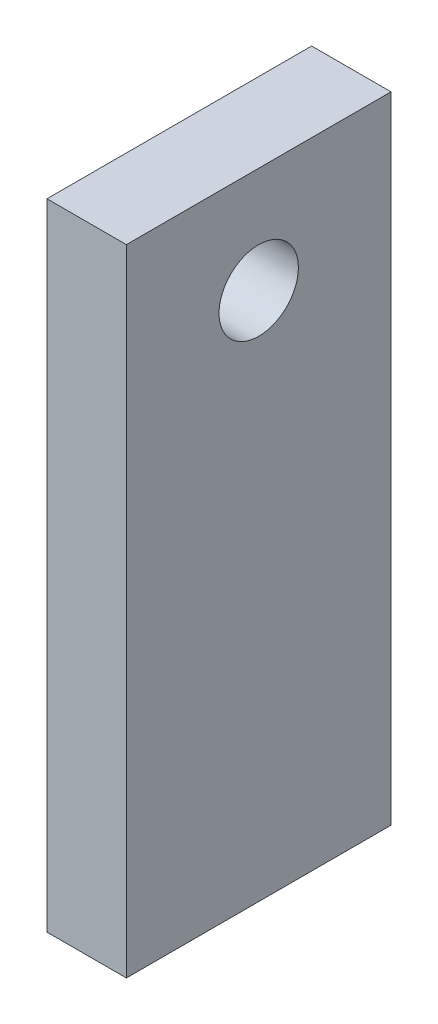
from build123d import *

# Parameters (mm, degrees)
SKETCH1_W           = 50
SKETCH1_H           = 120
BOSS_EXTRUDE1_DEPTH = 15
CUT_EXTRUDE1_REACH  = 68.708
SKETCH2_R           = 7.5


with BuildPart() as part:
    # Sketch1 → Boss-Extrude1 (new body)
    with BuildSketch(Plane(origin=(0, 0, 0), x_dir=(0, 0, -1), z_dir=(1, 0, 0))):
        Rectangle(SKETCH1_W, SKETCH1_H)
    extrude(amount=BOSS_EXTRUDE1_DEPTH)

    # Sketch2 → Cut-Extrude1 (cut, up to next)
    with BuildSketch(Plane(origin=(15, 0, 0), x_dir=(0, 0, -1), z_dir=(1, 0, 0)), mode=Mode.PRIVATE) as cut_extrude1_sk1:
        with Locations((0, 40)):
            Circle(SKETCH2_R)
    cut_extrude1_tool1 = extrude(cut_extrude1_sk1.sketch, amount=-CUT_EXTRUDE1_REACH, mode=Mode.PRIVATE) & part.part
    add(cut_extrude1_tool1.solids().sort_by_distance((15, 40, 0))[0], mode=Mode.SUBTRACT)


solid = part.part
